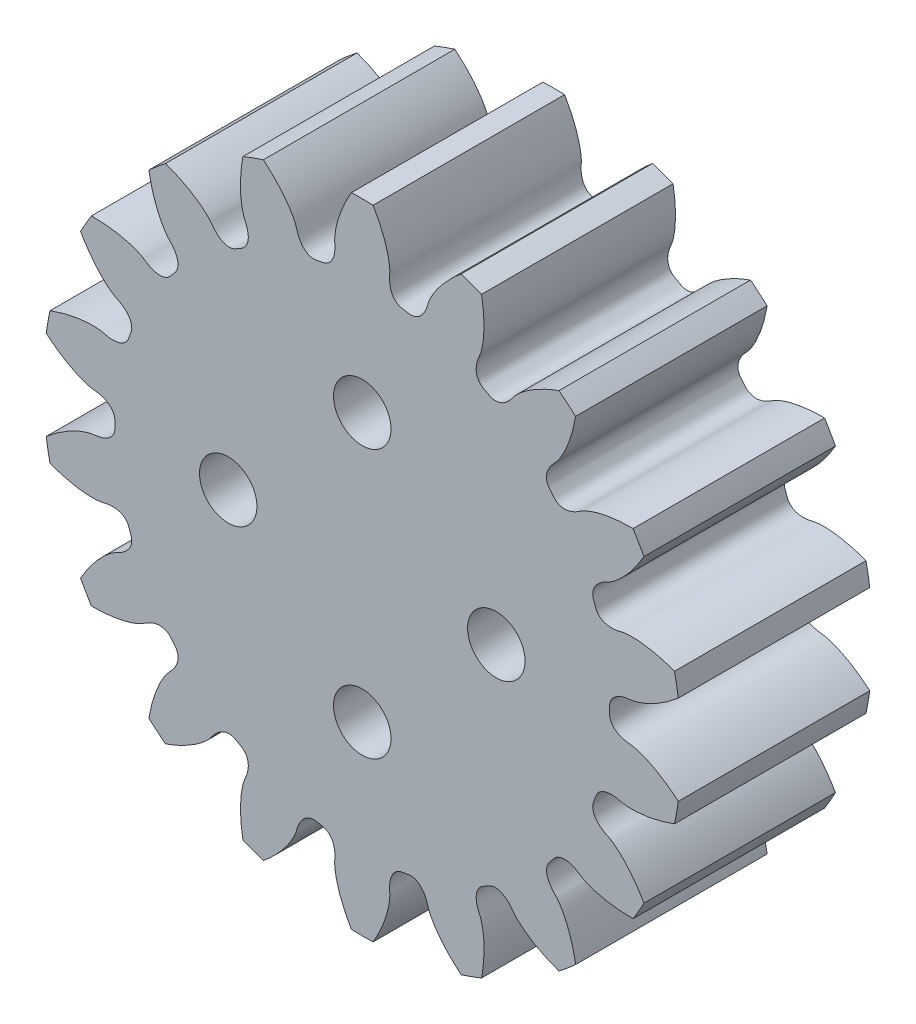
from build123d import *

# Parameters (mm, degrees)
SKETCHREVOLVESPURPINION_W       = 10
SKETCHREVOLVESPURPINION_H       = 16.666666667
TOOTHEXTRUDECUTSPURPINION_DEPTH = 9.525
PATTERNSPURPINION_COUNT         = 18
SKETCH_5_R                      = 1.5
CUT_EXTRUDE_2_DEPTH             = 5


with BuildPart() as part:
    # SketchRevolveSpurPinion → SpurPinion (revolve)
    with BuildSketch(Plane(origin=(0, 0, 0), x_dir=(0, 0, -1), z_dir=(1, 0, 0))):
        with Locations((-4.525, 8.333333334)):
            Rectangle(SKETCHREVOLVESPURPINION_W, SKETCHREVOLVESPURPINION_H)
    revolve(axis=Axis((0, 0, 0), (0, 0, -1)))

    # SketchToothSpurPinion → ToothExtrudeCutSpurPinion (cut, symmetric)
    with BuildSketch(Plane.XY):
        with BuildLine():
            ThreePointArc((16.577538036, 2.397442942), (16.75, 0), (16.577538036, -2.397442942))
            add(Edge.make_bspline(
                [(16.577538036, -2.397442942), (16.374498798, -2.221463075), (16.101029706, -2.004673022), (15.751997223, -1.764612508), (15.562506429, -1.643045597), (15.381686095, -1.535062353), (15.210200236, -1.439974059), (15.048677102, -1.357062905), (14.897708322, -1.285584675), (14.757847791, -1.224770127), (14.62961071, -1.173826637), (14.513472649, -1.131940149), (14.409868771, -1.098276086), (14.319192846, -1.071983693), (14.241797185, -1.052190137), (14.177990155, -1.038024731), (14.128040711, -1.028559511), (14.092164877, -1.022968161), (14.070554346, -1.020178648), (14.02801559, -1.016299731), (13.976987357, -1.012307566), (13.913241377, -1.004452405), (13.867279458, -0.997974959), (13.822175785, -0.990636485), (13.777913393, -0.982471505), (13.734477752, -0.973461306), (13.691851262, -0.963596207), (13.65001465, -0.952858424), (13.608946622, -0.941225593), (13.568624062, -0.928668713), (13.529022203, -0.915151364), (13.490114999, -0.900628381), (13.451875684, -0.885044443), (13.414277639, -0.868332438), (13.377295655, -0.850411654), (13.340907734, -0.831185819), (13.305097617, -0.810541049), (13.26985824, -0.788343874), (13.23519638, -0.764439557), (13.201138759, -0.738651092), (13.167739867, -0.710779484), (13.135091628, -0.680606116), (13.103334833, -0.647898347), (13.072671789, -0.612419712), (13.043378884, -0.573946237), (13.015816859, -0.532290094), (12.990434975, -0.487331018), (12.967765783, -0.439053775), (12.948401094, -0.38758833), (12.932964642, -0.333241586), (12.922010001, -0.276524361), (12.916590239, -0.22268873), (12.914252804, -0.130341155), (12.918577104, 0), (12.914252804, 0.130341155), (12.916590239, 0.22268873), (12.922010001, 0.276524361), (12.932964642, 0.333241586), (12.948401094, 0.38758833), (12.967765783, 0.439053775), (12.990434975, 0.487331018), (13.015816859, 0.532290094), (13.043378884, 0.573946237), (13.072671789, 0.612419712), (13.103334833, 0.647898347), (13.135091628, 0.680606116), (13.167739867, 0.710779484), (13.201138759, 0.738651092), (13.23519638, 0.764439557), (13.26985824, 0.788343874), (13.305097617, 0.810541049), (13.340907734, 0.831185819), (13.377295655, 0.850411654), (13.414277639, 0.868332438), (13.451875684, 0.885044443), (13.490114999, 0.900628381), (13.529022203, 0.915151364), (13.568624062, 0.928668713), (13.608946622, 0.941225593), (13.65001465, 0.952858424), (13.691851262, 0.963596207), (13.734477752, 0.973461306), (13.777913393, 0.982471505), (13.822175785, 0.990636485), (13.867279458, 0.997974959), (13.913241377, 1.004452405), (13.976987357, 1.012307566), (14.02801559, 1.016299731), (14.070554346, 1.020178648), (14.092164877, 1.022968161), (14.128040711, 1.028559511), (14.177990155, 1.038024731), (14.241797185, 1.052190137), (14.319192846, 1.071983693), (14.409868771, 1.098276086), (14.513472649, 1.131940149), (14.62961071, 1.173826637), (14.757847791, 1.224770127), (14.897708322, 1.285584675), (15.048677102, 1.357062905), (15.210200236, 1.439974059), (15.381686095, 1.535062353), (15.562506429, 1.643045597), (15.751997223, 1.764612508), (16.101029706, 2.004673022), (16.374498798, 2.221463075), (16.577538036, 2.397442942)],
                knots=[0, 0, 0, 0, 0.086681892, 0.112454454, 0.136665043, 0.159313658, 0.1804003, 0.199924969, 0.217887664, 0.234288386, 0.249127134, 0.262403909, 0.274118711, 0.284271539, 0.292862394, 0.299891276, 0.305358185, 0.30926312, 0.311606084, 0.312387082, 0.323045666, 0.328117752, 0.333108821, 0.33802219, 0.342861525, 0.34763088, 0.352334746, 0.356978107, 0.3615665, 0.366106083, 0.370603711, 0.375067019, 0.379504513, 0.383925662, 0.388341001, 0.39276222, 0.397202256, 0.401675347, 0.406197062, 0.410784251, 0.415454908, 0.420227881, 0.425122382, 0.430157244, 0.435349849, 0.44071472, 0.446261769, 0.451994334, 0.45790724, 0.46398525, 0.470202375, 0.476522482, 0.481418853, 0.5, 0.518581147, 0.523477518, 0.529797625, 0.53601475, 0.54209276, 0.548005666, 0.553738231, 0.55928528, 0.564650151, 0.569842756, 0.574877618, 0.579772119, 0.584545092, 0.589215749, 0.593802938, 0.598324653, 0.602797744, 0.60723778, 0.611658999, 0.616074338, 0.620495487, 0.624932981, 0.629396289, 0.633893917, 0.6384335, 0.643021893, 0.647665254, 0.65236912, 0.657138475, 0.66197781, 0.666891179, 0.671882248, 0.676954334, 0.687612918, 0.688393916, 0.69073688, 0.694641815, 0.700108724, 0.707137606, 0.715728461, 0.725881289, 0.737596091, 0.750872866, 0.765711614, 0.782112336, 0.800075031, 0.8195997, 0.840686342, 0.863334957, 0.887545546, 0.913318108, 1, 1, 1, 1], degree=3))
        make_face()
    toothextrudecutspurpinion = extrude(amount=TOOTHEXTRUDECUTSPURPINION_DEPTH, both=True, mode=Mode.SUBTRACT)

    # PatternSpurPinion: ToothExtrudeCutSpurPinion ×18 about axis
    patternspurpinion_axis = Axis((0, 0, 50), (0, 0, -1))
    for i in range(1, PATTERNSPURPINION_COUNT):
        add(toothextrudecutspurpinion.rotate(patternspurpinion_axis, i * 360 / PATTERNSPURPINION_COUNT), mode=Mode.SUBTRACT)

    # Эскиз5 → Вырез-Вытянуть2 (cut)
    with BuildSketch(Plane.XY.offset(9.525)):
        with Locations((0, 7)):
            Circle(SKETCH_5_R)
        with Locations((7, 0)):
            Circle(SKETCH_5_R)
        with Locations((0, -7)):
            Circle(SKETCH_5_R)
        with Locations((-7, 0)):
            Circle(SKETCH_5_R)
    extrude(amount=-CUT_EXTRUDE_2_DEPTH, mode=Mode.SUBTRACT)


solid = part.part
